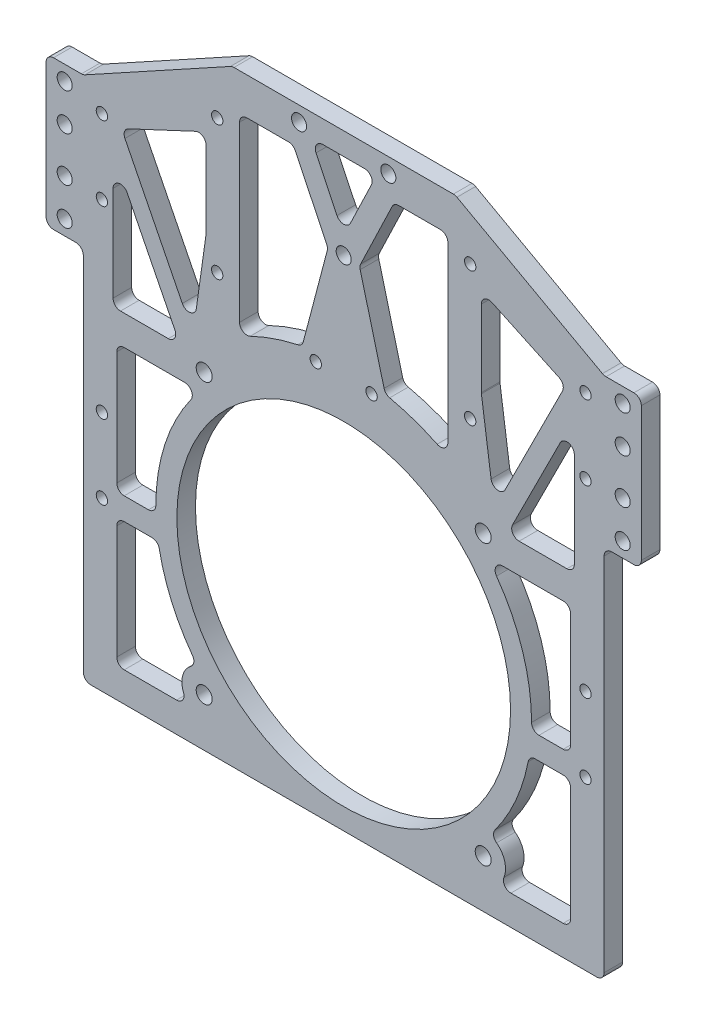
from build123d import *

# Parameters (mm, degrees)
SKETCH_1_W           = 160
SKETCH_1_H           = 163
EXTRUDE_1_DEPTH      = 5
SKETCH_2_R           = 44.85
CUT_EXTRUDE_1_DEPTH  = 5
SKETCH_3_R           = 2.025
CUT_EXTRUDE_2_DEPTH  = 30.8
SKETCH_5_R           = 1.525
CUT_EXTRUDE_3_DEPTH  = 10
SKETCH_6_R           = 2.15
CUT_EXTRUDE_4_DEPTH  = 10
SKETCH_7_W           = 10
SKETCH_7_H           = 86.5
CUT_EXTRUDE_5_DEPTH  = 10
SKETCH_8_R           = 1.525
CUT_EXTRUDE_6_DEPTH  = 10
SKETCH_9_R           = 1.525
CUT_EXTRUDE_7_DEPTH  = 10
CUT_EXTRUDE_8_DEPTH  = 10
EXTRUDE_2_DEPTH      = 5
FILLET_1_R           = 2
CUT_EXTRUDE_14_DEPTH = 10
SKETCH_14_W          = 10
SKETCH_14_H          = 14.5
CUT_EXTRUDE_15_DEPTH = 10
SKETCH_15_R          = 2.025
CUT_EXTRUDE_16_DEPTH = 10
FILLET_2_R           = 2
CUT_EXTRUDE_17_DEPTH = 10
CUT_EXTRUDE_18_DEPTH = 10
CUT_EXTRUDE_19_DEPTH = 10
EXTRUDE_3_DEPTH      = 5
FILLET_3_R           = 2
SKETCH_20_R          = 2.025
CUT_EXTRUDE_20_DEPTH = 10


with BuildPart() as part:
    # 草图1 → 凸台-拉伸1 (new body)
    with BuildSketch(Plane.XY):
        Rectangle(SKETCH_1_W, SKETCH_1_H)
    extrude(amount=EXTRUDE_1_DEPTH)

    # 草图2 → 切除-拉伸1 (cut)
    with BuildSketch(Plane(origin=(0, 0, 0), x_dir=(-1, 0, 0), z_dir=(0, 0, -1))):
        with Locations((0, -31)):
            Circle(SKETCH_2_R)
    extrude(amount=-CUT_EXTRUDE_1_DEPTH, mode=Mode.SUBTRACT)

    # 草图3 → 切除-拉伸2 (cut)
    with BuildSketch(Plane(origin=(0, 0, 0), x_dir=(-1, 0, 0), z_dir=(0, 0, -1))):
        with Locations((0, 52.5)):
            Circle(SKETCH_3_R)
        with Locations((-12, 77.5)):
            Circle(SKETCH_3_R)
        with Locations((12, 77.5)):
            Circle(SKETCH_3_R)
    extrude(amount=-CUT_EXTRUDE_2_DEPTH, mode=Mode.SUBTRACT)

    # 草图5 → 切除-拉伸3 (cut)
    with BuildSketch(Plane(origin=(0, 0, 0), x_dir=(-1, 0, 0), z_dir=(0, 0, -1))):
        with Locations((-7.5, 24)):
            Circle(SKETCH_5_R)
        with Locations((7.5, 24)):
            Circle(SKETCH_5_R)
    extrude(amount=-CUT_EXTRUDE_3_DEPTH, mode=Mode.SUBTRACT)

    # 草图6 → 切除-拉伸4 (cut)
    with BuildSketch(Plane(origin=(0, 0, 0), x_dir=(-1, 0, 0), z_dir=(0, 0, -1))):
        with Locations((37.5, -68.54)):
            Circle(SKETCH_6_R)
        with Locations((-37.5, -68.54)):
            Circle(SKETCH_6_R)
        with Locations((37.5, 6.54)):
            Circle(SKETCH_6_R)
        with Locations((-37.5, 6.54)):
            Circle(SKETCH_6_R)
    extrude(amount=-CUT_EXTRUDE_4_DEPTH, mode=Mode.SUBTRACT)

    # 草图7 → 切除-拉伸5 (cut)
    with BuildSketch(Plane(origin=(0, 0, 0), x_dir=(-1, 0, 0), z_dir=(0, 0, -1))):
        with Locations((-75, -38.25)):
            Rectangle(SKETCH_7_W, SKETCH_7_H)
        with Locations((75, -38.25)):
            Rectangle(SKETCH_7_W, SKETCH_7_H)
    extrude(amount=-CUT_EXTRUDE_5_DEPTH, mode=Mode.SUBTRACT)

    # 草图8 → 切除-拉伸6 (cut)
    with BuildSketch(Plane.XY.offset(5)):
        with Locations((65, -36.5)):
            Circle(SKETCH_8_R)
        with Locations((65, -16.5)):
            Circle(SKETCH_8_R)
        with Locations((65, 33.000036)):
            Circle(SKETCH_8_R)
        with Locations((65, 53.000036)):
            Circle(SKETCH_8_R)
        with Locations((34, 31.5)):
            Circle(SKETCH_8_R)
    cut_extrude_6 = extrude(amount=-CUT_EXTRUDE_6_DEPTH, mode=Mode.SUBTRACT)

    # 镜向1: 切除-拉伸6 across plane
    add(cut_extrude_6.mirror(Plane(origin=(0, 0, 0), x_dir=(0, 0, 1), z_dir=(1, 0, 0))), mode=Mode.SUBTRACT)

    # 草图9 → 切除-拉伸7 (cut)
    with BuildSketch(Plane(origin=(0, 0, 0), x_dir=(-1, 0, 0), z_dir=(0, 0, -1))):
        with Locations((-34, 67.5)):
            Circle(SKETCH_9_R)
    cut_extrude_7 = extrude(amount=-CUT_EXTRUDE_7_DEPTH, mode=Mode.SUBTRACT)

    # 镜向2: 切除-拉伸7 across plane
    add(cut_extrude_7.mirror(Plane(origin=(0, 0, 0), x_dir=(0, 0, 1), z_dir=(1, 0, 0))), mode=Mode.SUBTRACT)

    # 草图11 → 切除-拉伸8 (cut)
    with BuildSketch(Plane(origin=(0, 0, 0), x_dir=(-1, 0, 0), z_dir=(0, 0, -1))):
        with BuildLine():
            Line((-38.61862763, 1.54), (-61, 1.54))
            Line((-61, 1.54), (-61, -73.5))
            Line((-61, -73.5), (-40.876151655, -73.5))
            ThreePointArc((-40.876151655, -73.5), (-43.430578157, -67.629921585), (-39.233549586, -62.795889465))
            ThreePointArc((-39.233549586, -62.795889465), (-50.497693439, -30.517343419), (-38.61862763, 1.54))
        make_face()
    cut_extrude_8 = extrude(amount=-CUT_EXTRUDE_8_DEPTH, mode=Mode.SUBTRACT)

    # 镜向3: 切除-拉伸8 across plane
    add(cut_extrude_8.mirror(Plane(origin=(0, 0, 0), x_dir=(0, 0, 1), z_dir=(1, 0, 0))), mode=Mode.SUBTRACT)

    # 草图12 → 凸台-拉伸2 (add)
    with BuildSketch(Plane(origin=(0, 0, 0), x_dir=(-1, 0, 0), z_dir=(0, 0, -1))):
        Polygon((-61, -38.98), (-49.865515138, -38.98), (-50.253851594, -32.98), (-61, -32.98), align=None)
    extrude_2 = extrude(amount=-EXTRUDE_2_DEPTH)

    # 镜向4: 凸台-拉伸2 across plane
    add(extrude_2.mirror(Plane(origin=(0, 0, 0), x_dir=(0, 0, 1), z_dir=(1, 0, 0))))

    # 圆角1
    fillet_1_edges = [part.edges().sort_by_distance(p)[0] for p in [
        (39.233549586, -62.795889465, 2.5),
        (40.876151655, -73.5, 2.5),
        (61, -73.5, 2.5),
        (61, 1.54, 2.5),
        (38.61862763, 1.54, 2.5),
        (-40.876151655, -73.5, 2.5),
        (-39.233549586, -62.795889465, 2.5),
        (-38.61862763, 1.54, 2.5),
        (-61, 1.54, 2.5),
        (-61, -73.5, 2.5),
        (50.461169229, -32.98, 2.5),
        (61, -38.98, 2.5),
        (61, -32.98, 2.5),
        (49.865515138, -38.98, 2.5),
        (-50.461169229, -32.98, 2.5),
        (-49.865515138, -38.98, 2.5),
        (-61, -38.98, 2.5),
        (-61, -32.98, 2.5),
    ]]
    fillet(fillet_1_edges, radius=FILLET_1_R)

    # 草图13 → 切除-拉伸14 (cut)
    with BuildSketch(Plane(origin=(0, 0, 0), x_dir=(-1, 0, 0), z_dir=(0, 0, -1))):
        Polygon((-80, 59.5), (-70, 59.5), (-30, 81.5), (-80, 81.5), align=None)
        Polygon((80, 81.5), (80, 59.5), (70, 59.5), (30, 81.5), align=None)
    extrude(amount=-CUT_EXTRUDE_14_DEPTH, mode=Mode.SUBTRACT)

    # 草图14 → 切除-拉伸15 (cut)
    with BuildSketch(Plane.XY.offset(5)):
        with Locations((75, 12.25)):
            Rectangle(SKETCH_14_W, SKETCH_14_H)
    cut_extrude_15 = extrude(amount=-CUT_EXTRUDE_15_DEPTH, mode=Mode.SUBTRACT)

    # 镜向5: 切除-拉伸15 across plane
    add(cut_extrude_15.mirror(Plane(origin=(0, 0, 0), x_dir=(0, 0, 1), z_dir=(1, 0, 0))), mode=Mode.SUBTRACT)

    # 草图15 → 切除-拉伸16 (cut)
    with BuildSketch(Plane(origin=(0, 0, 0), x_dir=(-1, 0, 0), z_dir=(0, 0, -1))):
        with Locations((75, 23.5)):
            Circle(SKETCH_15_R)
        with Locations((75, 55.5)):
            Circle(SKETCH_15_R)
    cut_extrude_16 = extrude(amount=-CUT_EXTRUDE_16_DEPTH, mode=Mode.SUBTRACT)

    # 圆角2
    fillet_2_edges = [part.edges().sort_by_distance(p)[0] for p in [
        (-80, 59.5, 2.5),
        (30, 81.5, 2.5),
        (70, 59.5, 2.5),
        (80, 59.5, 2.5),
        (-70, 59.5, 2.5),
        (-30, 81.5, 2.5),
        (80, 19.5, 2.5),
        (70, 19.5, 2.5),
        (-80, 19.5, 2.5),
        (-70, 19.5, 2.5),
        (70, -81.5, 2.5),
        (-70, -81.5, 2.5),
    ]]
    fillet(fillet_2_edges, radius=FILLET_2_R)

    # 镜向6: 切除-拉伸16 across plane
    add(cut_extrude_16.mirror(Plane(origin=(0, 0, 0), x_dir=(0, 0, 1), z_dir=(1, 0, 0))), mode=Mode.SUBTRACT)

    # 草图16 → 切除-拉伸17 (cut)
    with BuildSketch(Plane.XY.offset(5)):
        Polygon((-8.82153206, 75.5), (8.82153206, 75.5), (0, 57.121808208), align=None)
    extrude(amount=-CUT_EXTRUDE_17_DEPTH, mode=Mode.SUBTRACT)

    # 草图17 → 切除-拉伸18 (cut)
    with BuildSketch(Plane.XY.offset(5)):
        with BuildLine():
            Line((-28, 71.5), (-28, 19.622351783))
            ThreePointArc((-28, 19.622351783), (-19.825425578, 23.34680304), (-11.172811949, 25.760820758))
            Line((-11.172811949, 25.760820758), (-4.242683725, 52.09530801))
            Line((-4.242683725, 52.09530801), (-13.55693588, 71.5))
            Line((-13.55693588, 71.5), (-28, 71.5))
        make_face()
        with BuildLine():
            Line((4.242683725, 52.09530801), (11.172811949, 25.760820758))
            ThreePointArc((11.172811949, 25.760820758), (19.825425578, 23.34680304), (28, 19.622351783))
            Line((28, 19.622351783), (28, 71.5))
            Line((28, 71.5), (13.55693588, 71.5))
            Line((13.55693588, 71.5), (4.242683725, 52.09530801))
        make_face()
    extrude(amount=-CUT_EXTRUDE_18_DEPTH, mode=Mode.SUBTRACT)

    # 草图18 → 切除-拉伸19 (cut)
    with BuildSketch(Plane.XY.offset(5)):
        Polygon((62, 51.091305291), (62, 9.54), (41.118461228, 9.54), (37, 38.910512072), (37, 62.784824645), align=None)
    cut_extrude_19 = extrude(amount=-CUT_EXTRUDE_19_DEPTH, mode=Mode.SUBTRACT)

    # 镜向7: 切除-拉伸19 across plane
    add(cut_extrude_19.mirror(Plane(origin=(0, 0, 0), x_dir=(0, 0, 1), z_dir=(1, 0, 0))), mode=Mode.SUBTRACT)

    # 草图19 → 凸台-拉伸3 (add)
    with BuildSketch(Plane(origin=(0, 0, 0), x_dir=(-1, 0, 0), z_dir=(0, 0, -1))):
        Polygon((-64.233786377, 49.968719694), (-43.352247605, 8.417414403), (-38.884674851, 10.662585597), (-59.766213623, 52.213890887), align=None)
        Polygon((59.766213623, 52.213890887), (38.884674851, 10.662585597), (43.352247605, 8.417414403), (64.233786377, 49.968719694), align=None)
    extrude(amount=-EXTRUDE_3_DEPTH)

    # 圆角3
    fillet_3_edges = [part.edges().sort_by_distance(p)[0] for p in [
        (0, 57.121808208, 2.5),
        (-8.82153206, 75.5, 2.5),
        (8.82153206, 75.5, 2.5),
        (-28, 71.5, 2.5),
        (-13.55693588, 71.5, 2.5),
        (-4.242683725, 52.09530801, 2.5),
        (-11.172811949, 25.760820758, 2.5),
        (-28, 19.622351783, 2.5),
        (28, 19.622351783, 2.5),
        (11.172811949, 25.760820758, 2.5),
        (4.242683725, 52.09530801, 2.5),
        (13.55693588, 71.5, 2.5),
        (28, 71.5, 2.5),
        (37, 62.784824645, 2.5),
        (62, 9.54, 2.5),
        (37, 38.910512072, 2.5),
        (-37, 62.784824645, 2.5),
        (-37, 38.910512072, 2.5),
        (-62, 9.54, 2.5),
        (40.508075413, 13.892922839, 2.5),
        (43.916401114, 9.54, 2.5),
        (62, 45.523801112, 2.5),
        (59.734575987, 52.150936472, 2.5),
        (-62, 45.523801112, 2.5),
        (-40.508075413, 13.892922839, 2.5),
        (-43.916401114, 9.54, 2.5),
        (-59.734575987, 52.150936472, 2.5),
    ]]
    fillet(fillet_3_edges, radius=FILLET_3_R)

    # 草图20 → 切除-拉伸20 (cut)
    with BuildSketch(Plane(origin=(0, 0, 0), x_dir=(-1, 0, 0), z_dir=(0, 0, -1))):
        with Locations((-75, 45.5)):
            Circle(SKETCH_20_R)
        with Locations((-75, 33.5)):
            Circle(SKETCH_20_R)
    cut_extrude_20 = extrude(amount=-CUT_EXTRUDE_20_DEPTH, mode=Mode.SUBTRACT)

    # 镜向8: 切除-拉伸20 across plane
    add(cut_extrude_20.mirror(Plane(origin=(0, 0, 0), x_dir=(0, 0, 1), z_dir=(1, 0, 0))), mode=Mode.SUBTRACT)


solid = part.part
